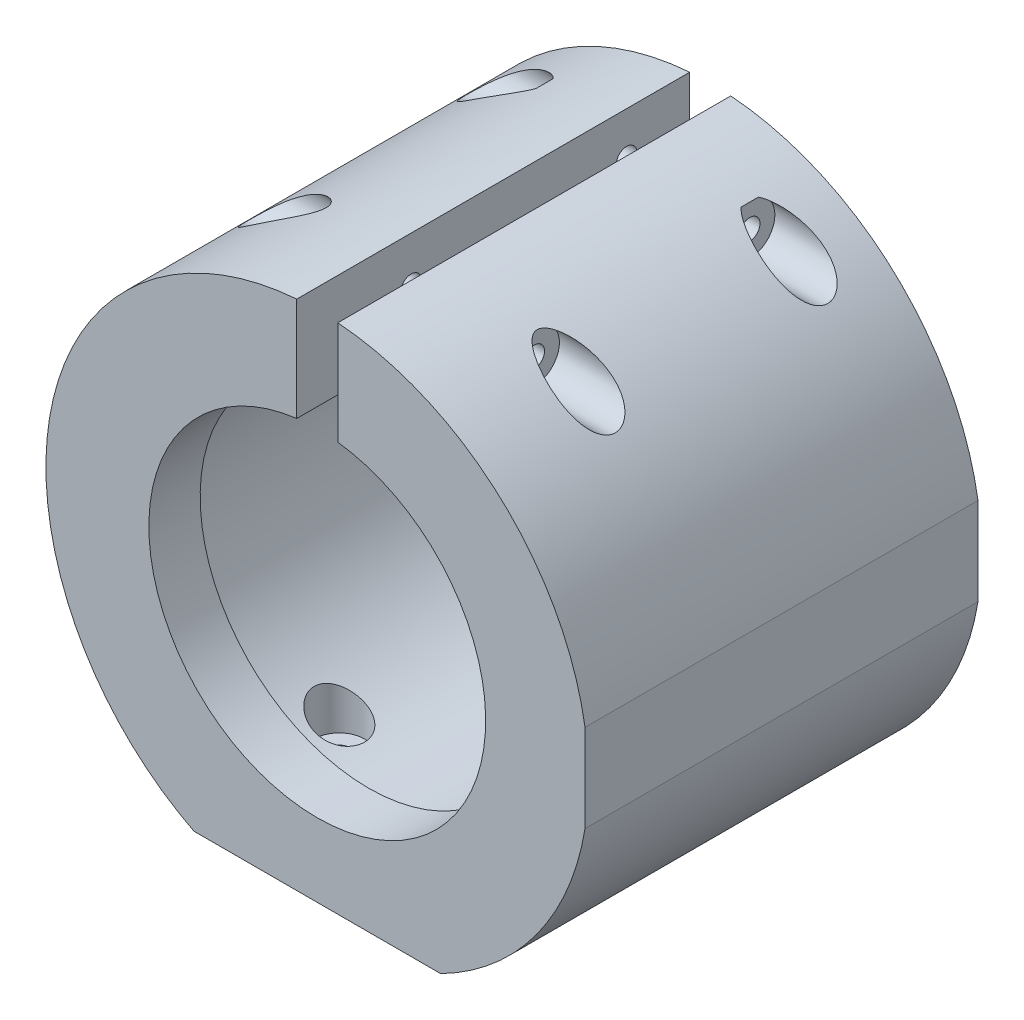
from build123d import *

# Parameters (mm, degrees)
SKETCH1_R               = 18.1
BOSS_EXTRUDE1_DEPTH     = 33.3
SKETCH2_R               = 1
CUT_EXTRUDE1_DEPTH      = 9.3
SKETCH3_R               = 2.45
CUT_EXTRUDE2_DEPTH      = 9.3
SKETCH4_W               = 4
SKETCH4_H               = 29.158742143
CUT_EXTRUDE3_DEPTH      = 66.637335137
CUT_EXTRUDE4_DEPTH      = 67.411402336
CUT_EXTRUDE4_DEPTH_BACK = 67.411402336
SKETCH5_R               = 1
SKETCH6_R               = 2.45
CUT_EXTRUDE5_DEPTH      = 22
BOSS_EXTRUDE2_DEPTH     = 5


with BuildPart() as part:
    # Sketch1 → Boss-Extrude1 (new body)
    with BuildSketch(Plane.XY):
        with BuildLine():
            ThreePointArc((26.098059899, 27.8276923), (-15.592298008, 44.914409405), (-12.023310526, 0))
            Line((-12.023310526, 0), (12.023310526, 0))
            ThreePointArc((12.023310526, 0), (21.360009365, 7.962102032), (26.098059899, 19.28110778))
            Line((26.098059899, 19.28110778), (26.098059899, 27.8276923))
        make_face()
        with Locations((0, 23.55440004)):
            Circle(SKETCH1_R, mode=Mode.SUBTRACT)
    extrude(amount=BOSS_EXTRUDE1_DEPTH)

    # Sketch2 → Cut-Extrude1 (cut)
    with BuildSketch(Plane.XZ):
        with Locations(Location((-7.5, 28.65, 0), (0, 0, 270))):
            Circle(SKETCH2_R)
        with Locations(Location((7.5, 28.65, 0), (0, 0, 270))):
            Circle(SKETCH2_R)
        with Locations(Location((-7.5, 4.65, 0), (0, 0, 270))):
            Circle(SKETCH2_R)
        with Locations(Location((7.5, 4.65, 0), (0, 0, 270))):
            Circle(SKETCH2_R)
    extrude(amount=-CUT_EXTRUDE1_DEPTH, mode=Mode.SUBTRACT)

    # Sketch3 → Cut-Extrude2 (cut)
    with BuildSketch(Plane(origin=(0, 4, 0), x_dir=(-1, 0, 0), z_dir=(0, -1, 0))):
        with Locations(Location((-7.5, -4.65, 0), (0, 0, 90))):
            Circle(SKETCH3_R)
        with Locations(Location((7.5, -4.65, 0), (0, 0, 90))):
            Circle(SKETCH3_R)
        with Locations(Location((-7.5, -28.65, 0), (0, 0, 90))):
            Circle(SKETCH3_R)
        with Locations(Location((7.5, -28.65, 0), (0, 0, 90))):
            Circle(SKETCH3_R)
    extrude(amount=-CUT_EXTRUDE2_DEPTH, mode=Mode.SUBTRACT)

    # Sketch4 → Cut-Extrude3 (cut, through all)
    with BuildSketch(Plane.XY.offset(33.3)):
        with Locations((0, 46.869056607)):
            Rectangle(SKETCH4_W, SKETCH4_H)
    extrude(amount=-CUT_EXTRUDE3_DEPTH, mode=Mode.SUBTRACT)

    # Sketch5 → Cut-Extrude4 (cut, two sides: drawn at the far end of the back side and taken through both)
    with BuildSketch(Plane.ZY.offset(-2).offset(-CUT_EXTRUDE4_DEPTH_BACK)):
        with Locations((6.15, 45.733914025)):
            Circle(SKETCH5_R)
        with Locations((27.15, 45.466040673)):
            Circle(SKETCH5_R)
    extrude(amount=CUT_EXTRUDE4_DEPTH + CUT_EXTRUDE4_DEPTH_BACK, mode=Mode.SUBTRACT)

    # Sketch6 → Cut-Extrude5 (cut)
    with BuildSketch(Plane.ZY.offset(-10)):
        with Locations((6.15, 45.733914025)):
            Circle(SKETCH6_R)
        with Locations((27.15, 45.466040673)):
            Circle(SKETCH6_R)
    cut_extrude5 = extrude(amount=-CUT_EXTRUDE5_DEPTH, mode=Mode.SUBTRACT)

    # Mirror1: Cut-Extrude5 across plane
    add(cut_extrude5.mirror(Plane(origin=(0, 0, 0), x_dir=(0, 0, 1), z_dir=(1, 0, 0))), mode=Mode.SUBTRACT)

    # Sketch7 → Boss-Extrude2 (add)
    with BuildSketch(Plane(origin=(0, 0, 33.3), x_dir=(-1, 0, 0), z_dir=(0, 0, -1))):
        with BuildLine():
            Line((-26.098059899, 19.28110778), (-26.098059899, 27.8276923))
            ThreePointArc((-26.098059899, 27.8276923), (-17.872880838, 43.046190307), (-2, 49.924264606))
            Line((-2, 49.924264606), (-2, 39.845441603))
            ThreePointArc((-2, 39.845441603), (0, 7.141050741), (2, 39.845441603))
            Line((2, 39.845441603), (2, 49.924264606))
            ThreePointArc((2, 49.924264606), (25.928196209, 28.760012261), (12.023310526, 0))
            Line((12.023310526, 0), (-12.023310526, 0))
            ThreePointArc((-12.023310526, 0), (-21.360009365, 7.962102032), (-26.098059899, 19.28110778))
        make_face()
    extrude(amount=-BOSS_EXTRUDE2_DEPTH)


solid = part.part
